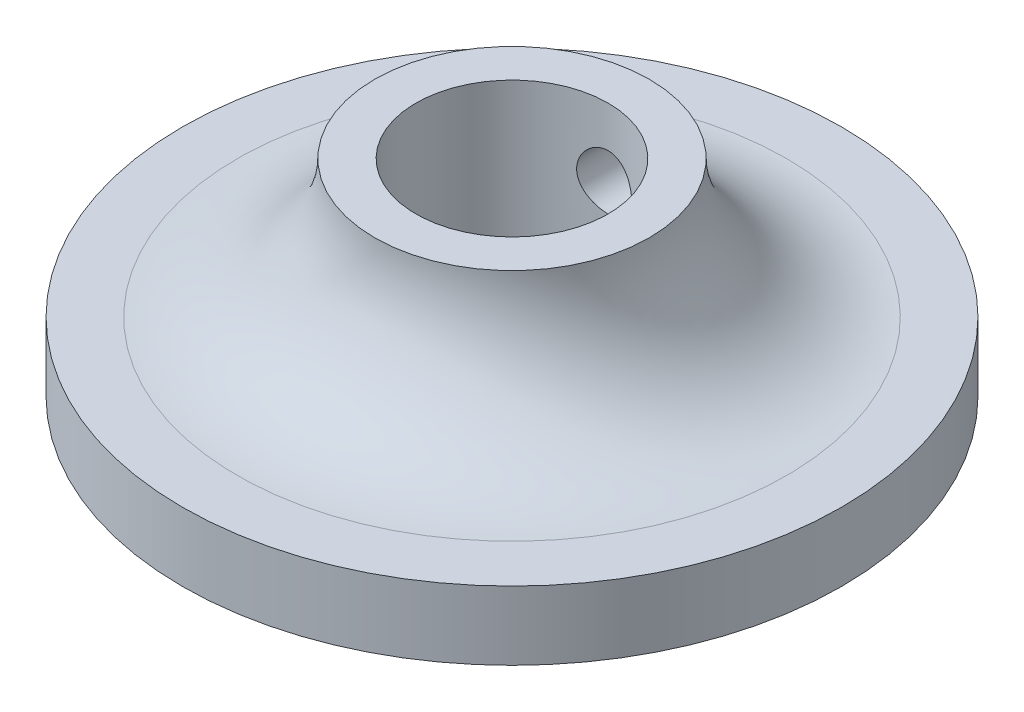
from build123d import *

# Parameters (mm, degrees)
CUT_EXTRUDE_2_DEPTH      = 30
CUT_EXTRUDE_2_DEPTH_BACK = 214.600093633
SKETCH_3_R               = 10


with BuildPart() as part:
    # Эскиз1 → Повернуть3 (revolve)
    with BuildSketch(Plane.XY):
        with BuildLine():
            Line((-120, 0), (-120, 25))
            Line((-120, 25), (-100, 25))
            ThreePointArc((-100, 25), (-64.644660941, 39.644660941), (-50, 75))
            Line((-50, 75), (-35, 75))
            Line((-35, 75), (-35, 25))
            Line((-35, 25), (0, 25))
            Line((0, 25), (0, 0))
            Line((0, 0), (-120, 0))
        make_face()
    revolve(axis=Axis((0, 0, 0), (0, 1, 0)))

    # Эскиз3 → Вырез-Вытянуть2 (cut, two sides: drawn at the far end of the back side and taken through both)
    with BuildSketch(Plane.XY.offset(-40).offset(-CUT_EXTRUDE_2_DEPTH_BACK)):
        with Locations((0, 50)):
            Circle(SKETCH_3_R)
    extrude(amount=CUT_EXTRUDE_2_DEPTH + CUT_EXTRUDE_2_DEPTH_BACK, mode=Mode.SUBTRACT)


solid = part.part
